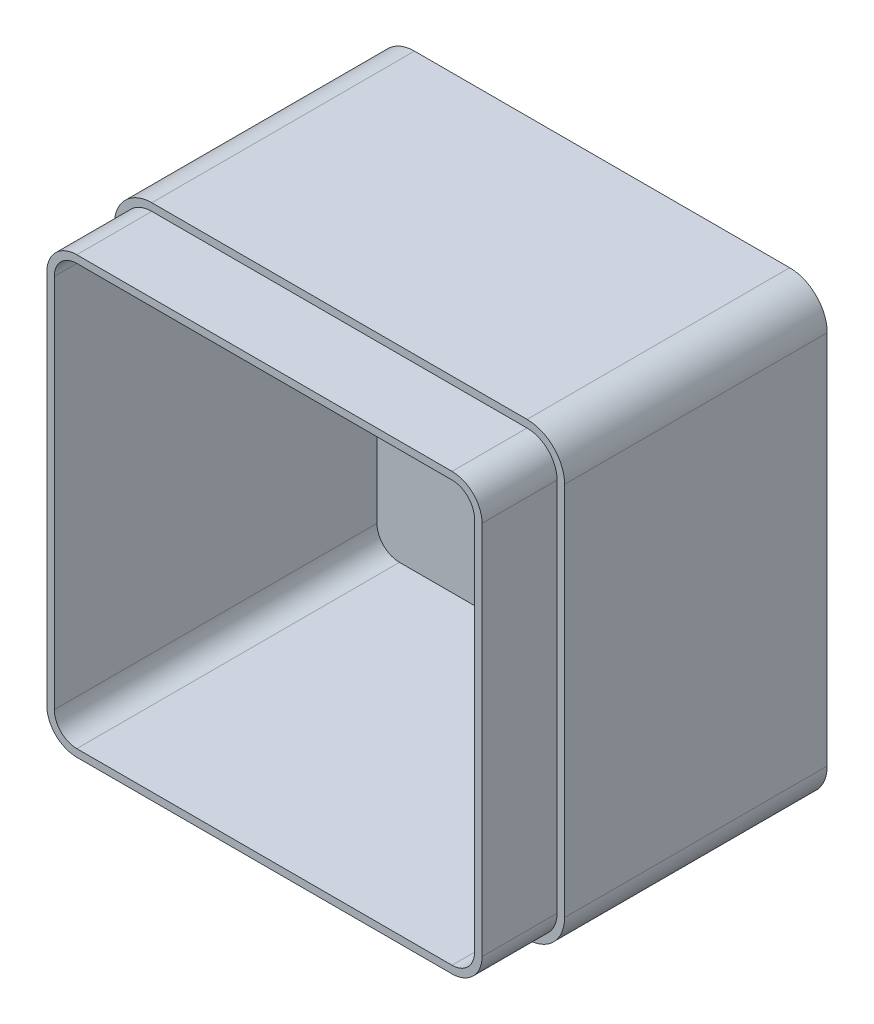
from build123d import *

# Parameters (mm, degrees)
SKETCH1_W           = 120
SKETCH1_H           = 120
BOSS_EXTRUDE1_DEPTH = 90
FILLET1_R           = 10
SHELL1_T            = -4
CUT_EXTRUDE1_DEPTH  = 20


with BuildPart() as part:
    # Sketch1 → Boss-Extrude1 (new body)
    with BuildSketch(Plane.XY):
        with Locations((60, 60)):
            Rectangle(SKETCH1_W, SKETCH1_H)
    extrude(amount=BOSS_EXTRUDE1_DEPTH)

    # Fillet1
    fillet1_edges = [part.edges().sort_by_distance(p)[0] for p in [
        (0, 120, 45),
        (120, 120, 45),
        (120, 0, 45),
        (0, 0, 45),
    ]]
    fillet(fillet1_edges, radius=FILLET1_R)

    # Shell1
    shell1_openings = [part.faces().sort_by_distance(p)[0] for p in [
        (60, 60, 90),
    ]]
    offset(amount=SHELL1_T, openings=shell1_openings, kind=Kind.INTERSECTION)

    # Sketch2 → Cut-Extrude1 (cut)
    with BuildSketch(Plane.XY.offset(90)):
        with BuildLine():
            Line((120, 10), (120, 110))
            ThreePointArc((120, 110), (117.071067812, 117.071067812), (110, 120))
            Line((110, 120), (10, 120))
            ThreePointArc((10, 120), (2.928932188, 117.071067812), (0, 110))
            Line((0, 110), (0, 10))
            ThreePointArc((0, 10), (2.928932188, 2.928932188), (10, 0))
            Line((10, 0), (110, 0))
            ThreePointArc((110, 0), (117.071067812, 2.928932188), (120, 10))
        make_face()
        with BuildLine():
            Line((118, 10), (118, 110))
            ThreePointArc((118, 110), (115.656854249, 115.656854249), (110, 118))
            Line((110, 118), (10, 118))
            ThreePointArc((10, 118), (4.343145751, 115.656854249), (2, 110))
            Line((2, 110), (2, 10))
            ThreePointArc((2, 10), (4.343145751, 4.343145751), (10, 2))
            Line((10, 2), (110, 2))
            ThreePointArc((110, 2), (115.656854249, 4.343145751), (118, 10))
        make_face(mode=Mode.SUBTRACT)
    extrude(amount=-CUT_EXTRUDE1_DEPTH, mode=Mode.SUBTRACT)


solid = part.part
